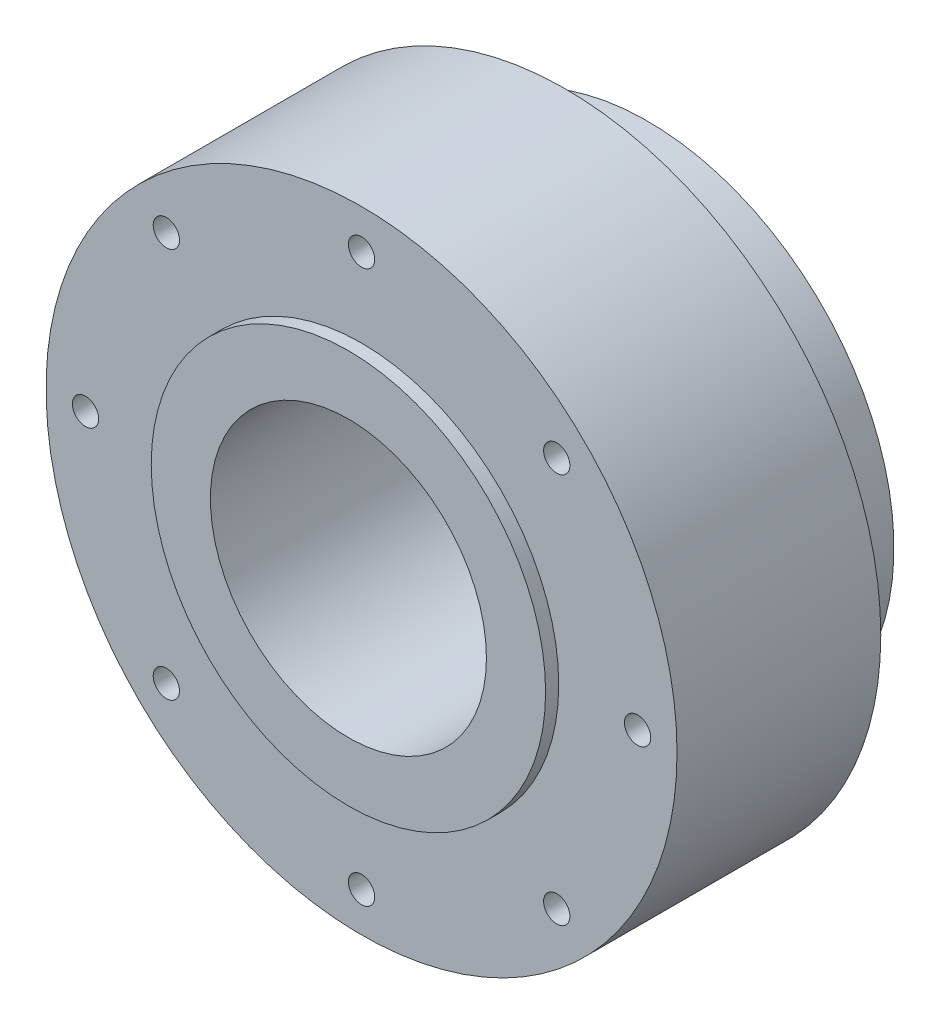
from build123d import *

# Parameters (mm, degrees)
SKETCH3_R           = 48
BOSS_EXTRUDE1_DEPTH = 31
SKETCH4_R           = 2
CUT_EXTRUDE1_DEPTH  = 3.5
SKETCH5_R           = 30
BOSS_EXTRUDE2_DEPTH = 2
SKETCH7_R           = 37.5
BOSS_EXTRUDE3_DEPTH = 12.5
SKETCH6_R           = 21
CUT_EXTRUDE3_DEPTH  = 33
CUT_EXTRUDE4_START  = -3.5
SKETCH8_R           = 2
CUT_EXTRUDE4_DEPTH  = 3.5


with BuildPart() as part:
    # Sketch3 → Boss-Extrude1 (new body)
    with BuildSketch(Plane.XY):
        Circle(SKETCH3_R)
    extrude(amount=BOSS_EXTRUDE1_DEPTH)

    # Sketch4 → Cut-Extrude1 (cut)
    with BuildSketch(Plane.XY.offset(31)):
        with Locations((0, 42)):
            Circle(SKETCH4_R)
        with Locations((29.69848481, 29.69848481)):
            Circle(SKETCH4_R)
        with Locations((42, 0)):
            Circle(SKETCH4_R)
        with Locations((29.69848481, -29.69848481)):
            Circle(SKETCH4_R)
        with Locations((0, -42)):
            Circle(SKETCH4_R)
        with Locations((-29.69848481, -29.69848481)):
            Circle(SKETCH4_R)
        with Locations((-42, 0)):
            Circle(SKETCH4_R)
        with Locations((-29.69848481, 29.69848481)):
            Circle(SKETCH4_R)
    extrude(amount=-CUT_EXTRUDE1_DEPTH, mode=Mode.SUBTRACT)

    # Sketch5 → Boss-Extrude2 (add)
    with BuildSketch(Plane.XY.offset(31)):
        Circle(SKETCH5_R)
    extrude(amount=BOSS_EXTRUDE2_DEPTH)

    # Sketch7 → Boss-Extrude3 (add)
    with BuildSketch(Plane(origin=(0, 0, 0), x_dir=(-1, 0, 0), z_dir=(0, 0, -1))):
        Circle(SKETCH7_R)
    extrude(amount=BOSS_EXTRUDE3_DEPTH)

    # Sketch6 → Cut-Extrude3 (cut)
    with BuildSketch(Plane.XY.offset(33)):
        Circle(SKETCH6_R)
    extrude(amount=-CUT_EXTRUDE3_DEPTH, mode=Mode.SUBTRACT)

    # Sketch8 → Cut-Extrude4 (cut)
    with BuildSketch(Plane(origin=(0, 0, 0), x_dir=(-1, 0, 0), z_dir=(0, 0, -1)).offset(CUT_EXTRUDE4_START)):
        with Locations(Location((0, 42, 0), (0, 0, 180))):
            Circle(SKETCH8_R)
        with Locations(Location((29.69848481, 29.69848481, 0), (0, 0, 180))):
            Circle(SKETCH8_R)
        with Locations(Location((42, 0, 0), (0, 0, 180))):
            Circle(SKETCH8_R)
        with Locations(Location((29.69848481, -29.69848481, 0), (0, 0, 180))):
            Circle(SKETCH8_R)
        with Locations(Location((0, -42, 0), (0, 0, 180))):
            Circle(SKETCH8_R)
        with Locations(Location((-29.69848481, -29.69848481, 0), (0, 0, 180))):
            Circle(SKETCH8_R)
        with Locations(Location((-42, 0, 0), (0, 0, 180))):
            Circle(SKETCH8_R)
        with Locations(Location((-29.69848481, 29.69848481, 0), (0, 0, 180))):
            Circle(SKETCH8_R)
    extrude(amount=CUT_EXTRUDE4_DEPTH, mode=Mode.SUBTRACT)


solid = part.part
